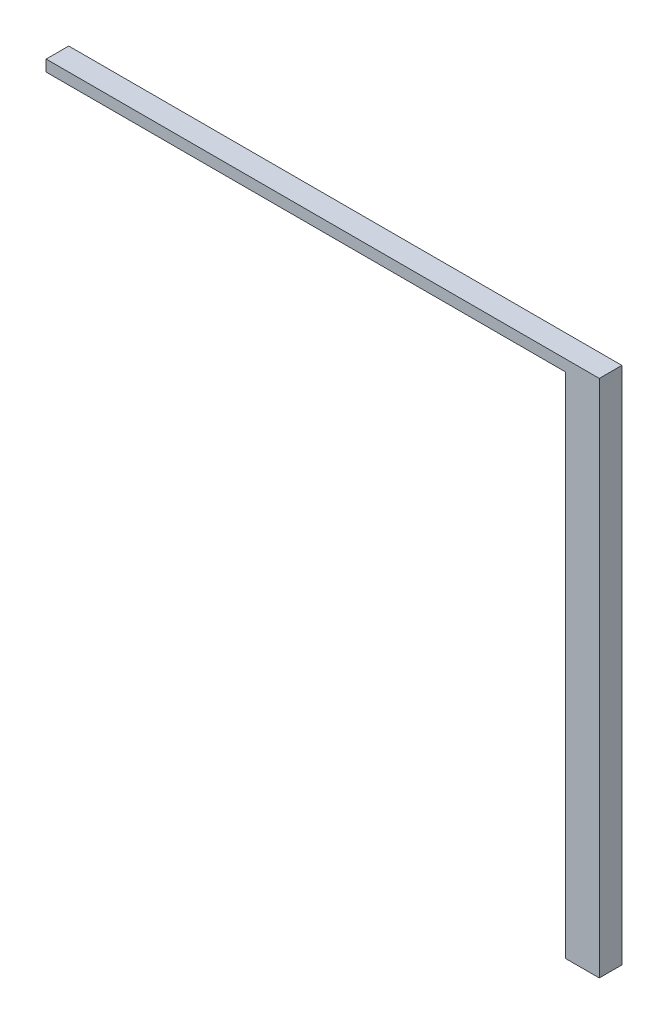
from build123d import *

# Parameters (mm, degrees)
SKETCH_1_W      = 30
SKETCH_1_H      = 20
EXTRUDE_1_DEPTH = 460
SKETCH_2_W      = 20
SKETCH_2_H      = 10
EXTRUDE_2_DEPTH = 460


with BuildPart() as part:
    # 草图1 → 凸台-拉伸1 (new body)
    with BuildSketch(Plane(origin=(0, 0, 0), x_dir=(1, 0, 0), z_dir=(0, 1, 0))):
        with Locations((-15, 10)):
            Rectangle(SKETCH_1_W, SKETCH_1_H)
    extrude(amount=EXTRUDE_1_DEPTH)

    # 草图2 → 凸台-拉伸2 (add)
    with BuildSketch(Plane.ZY.offset(30)):
        with Locations((-10, 455)):
            Rectangle(SKETCH_2_W, SKETCH_2_H)
    extrude(amount=EXTRUDE_2_DEPTH)


solid = part.part
